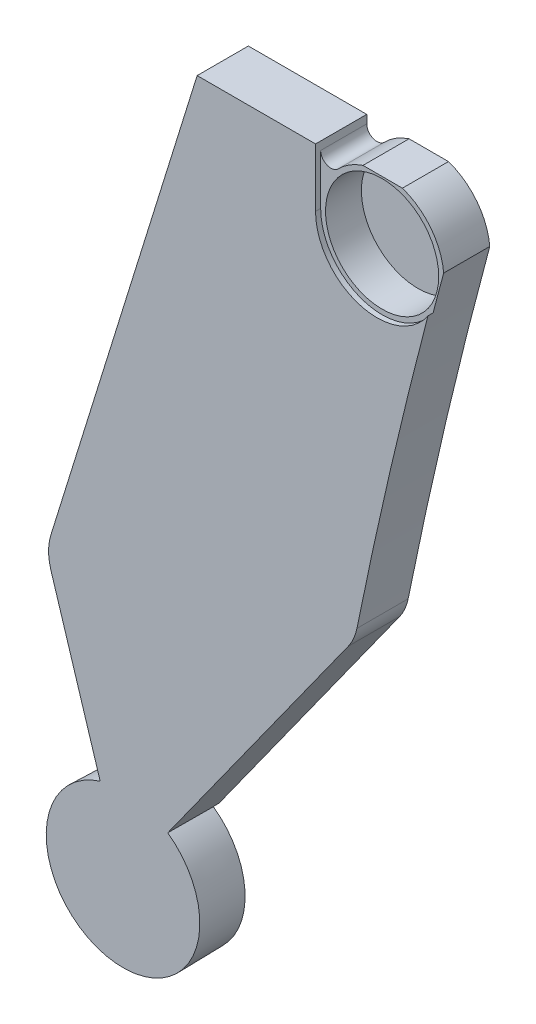
from build123d import *

# Parameters (mm, degrees)
BOSS_EXTRUDE1_DEPTH = 10
CUT_EXTRUDE3_REACH  = 312.322
SKETCH6_W           = 166.922568412
SKETCH6_H           = 253.34709858
BOSS_EXTRUDE2_DEPTH = 10
SKETCH11_R          = 15
BOSS_EXTRUDE4_DEPTH = 9
BOSS_EXTRUDE4_DRAFT = -1
FILLET1_R           = 10
SKETCH15_R          = 11.5
CUT_EXTRUDE6_DEPTH  = 7
SKETCH17_R          = 15
CUT_EXTRUDE7_DEPTH  = 2
CUT_EXTRUDE8_DEPTH  = 1
SKETCH19_R          = 11.05
CUT_EXTRUDE9_DEPTH  = 7
CUT_EXTRUDE10_DEPTH = 10
FILLET2_R           = 2
CUT_EXTRUDE11_DEPTH = 10
FILLET3_R           = 10


with BuildPart() as part:
    # Sketch2 → Boss-Extrude1 (new body)
    with BuildSketch(Plane.XY):
        with BuildLine():
            Line((0, 0), (70, 0))
            ThreePointArc((70, 0), (80.047115298, 146.372811683), (110, 290))
            Line((110, 290), (50, 290))
            ThreePointArc((50, 290), (12.591539765, 147.139389696), (0, 0))
        make_face()
    extrude(amount=BOSS_EXTRUDE1_DEPTH)

    # Sketch6 → Cut-Extrude3 (cut, up to next)
    with BuildSketch(Plane.XY.offset(10), mode=Mode.PRIVATE) as cut_extrude3_sk1:
        with Locations((50.25677389, 83.32645071)):
            Rectangle(SKETCH6_W, SKETCH6_H)
    cut_extrude3_tool1 = extrude(cut_extrude3_sk1.sketch, amount=-CUT_EXTRUDE3_REACH, mode=Mode.PRIVATE) & part.part
    add(cut_extrude3_tool1.solids().sort_by_distance((50.256774, 83.326451, 10))[0], mode=Mode.SUBTRACT)

    # Sketch8 → Boss-Extrude2 (add)
    with BuildSketch(Plane.XY.offset(10)):
        Polygon((25.847632867, 210), (45.521845529, 146.858679142), (90.78507317, 210), align=None)
    extrude(amount=-BOSS_EXTRUDE2_DEPTH)


with BuildPart() as boss_extrude4_tool:
    # Sketch11 → Boss-Extrude4 (with draft: the straight prism first)
    with BuildSketch(Plane.XY.offset(10)):
        with Locations((45.521845529, 146.858679142)):
            Circle(SKETCH11_R)
    extrude(amount=-BOSS_EXTRUDE4_DEPTH)
    # Boss-Extrude4: the draft: its side faces are tilted about the plane it starts from
    boss_extrude4_sides = [boss_extrude4_tool.faces().sort_by_distance(p)[0] for p in [
        (30.521845529, 146.858679142, 5.5),
    ]]
    draft(boss_extrude4_sides, Plane.XY.offset(10), BOSS_EXTRUDE4_DRAFT)


with BuildPart() as part_1:
    add(part.part)

    # Boss-Extrude4: add boss_extrude4_tool
    add(boss_extrude4_tool.part)

    # Fillet1
    fillet1_edges = [part_1.edges().sort_by_distance(p)[0] for p in [
        (25.847632867, 210, 5),
        (90.78507317, 210, 5),
    ]]
    fillet(fillet1_edges, radius=FILLET1_R)

    # Sketch15 → Cut-Extrude6 (cut, symmetric)
    with BuildSketch(Plane(origin=(0, 0, 1), x_dir=(-1, 0, 0), z_dir=(0, 0, -1))):
        with Locations((-45.521845529, 146.858679142)):
            Circle(SKETCH15_R)
    extrude(amount=CUT_EXTRUDE6_DEPTH, both=True, mode=Mode.SUBTRACT)

    # Sketch17 → Cut-Extrude7 (cut)
    with BuildSketch(Plane(origin=(0, 0, 1), x_dir=(-1, 0, 0), z_dir=(0, 0, -1))):
        with Locations((-45.521845529, 146.858679142)):
            Circle(SKETCH17_R)
    extrude(amount=CUT_EXTRUDE7_DEPTH, mode=Mode.SUBTRACT)

    # Sketch18 → Cut-Extrude8 (cut)
    with BuildSketch(Plane.XY.offset(10)):
        with BuildLine():
            Line((83.124410279, 278.596969533), (83.124410279, 292.663120803))
            Line((83.124410279, 292.663120803), (111.699174515, 292.663120803))
            Line((111.699174515, 292.663120803), (111.699174515, 271.967063838))
            Line((111.699174515, 271.967063838), (105.126627558, 271.967063838))
            ThreePointArc((105.126627558, 271.967063838), (91.662229416, 267.107265286), (83.124410279, 278.596969533))
        make_face()
    extrude(amount=-CUT_EXTRUDE8_DEPTH, mode=Mode.SUBTRACT)

    # Sketch19 → Cut-Extrude9 (cut)
    with BuildSketch(Plane.XY.offset(9)):
        with Locations((95.124410279, 278.596969533)):
            Circle(SKETCH19_R)
    extrude(amount=-CUT_EXTRUDE9_DEPTH, mode=Mode.SUBTRACT)

    # Sketch21 → Cut-Extrude10 (cut)
    with BuildSketch(Plane.XY.offset(9)):
        with BuildLine():
            Line((83.124410279, 278.596969533), (83.124410279, 291.961474959))
            Line((83.124410279, 291.961474959), (91.38664408, 291.961474959))
            Line((91.38664408, 291.961474959), (91.38664408, 290))
            ThreePointArc((91.38664408, 290), (85.407075398, 285.63780775), (83.124410279, 278.596969533))
        make_face()
        with BuildLine():
            Line((97.418656909, 290.449512128), (97.418656909, 291.961474959))
            Line((97.418656909, 291.961474959), (113.129922851, 291.961474959))
            Line((113.129922851, 291.961474959), (113.129922851, 278.596969533))
            Line((113.129922851, 278.596969533), (107.196954898, 278.596969533))
            ThreePointArc((107.196954898, 278.596969533), (104.436867753, 286.279707937), (97.418656909, 290.449512128))
        make_face()
    extrude(amount=-CUT_EXTRUDE10_DEPTH, mode=Mode.SUBTRACT)

    # Fillet2
    fillet2_edges = [part_1.edges().sort_by_distance(p)[0] for p in [
        (83.124410279, 278.596969533, 4.5),
    ]]
    fillet(fillet2_edges, radius=FILLET2_R)

    # Sketch22 → Cut-Extrude11 (cut)
    with BuildSketch(Plane.XY.offset(10)):
        Polygon((60, 290), (29.380219364, 191.412034288), (8.711867435, 204.425441059), (44.690109682, 301.643244577), align=None)
    extrude(amount=-CUT_EXTRUDE11_DEPTH, mode=Mode.SUBTRACT)

    # Fillet3
    fillet3_edges = [part_1.edges().sort_by_distance(p)[0] for p in [
        (30.508011562, 195.04324053, 5),
    ]]
    fillet(fillet3_edges, radius=FILLET3_R)


solid = part_1.part
